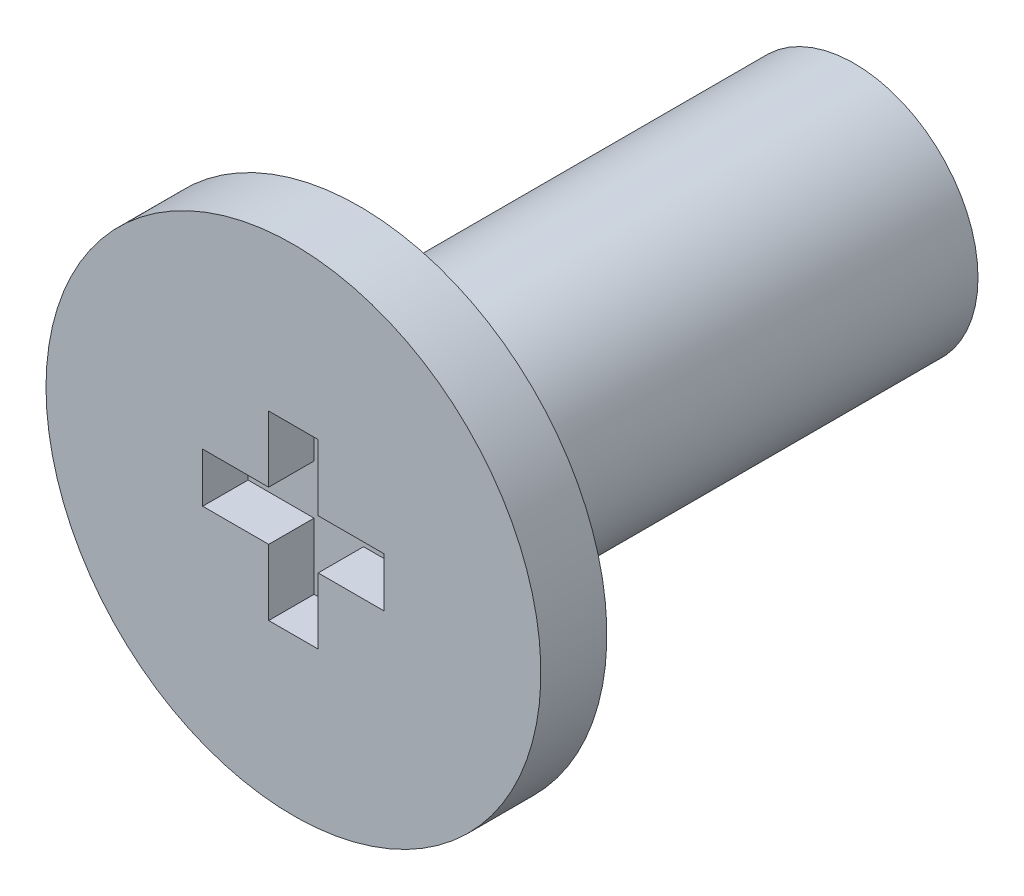
from build123d import *

# Parameters (mm, degrees)
SKETCH_1_R        = 1.5
EXTRUDE_198_DEPTH = 6
SKETCH_6_W        = 3
SKETCH_6_H        = 0.8
PH1_START         = 0.81
PH1_DEPTH         = 0.56


with BuildPart() as part:
    # 草图1 → Extrude 198 (new body)
    with BuildSketch(Plane.XY):
        Circle(SKETCH_1_R)
    extrude(amount=-EXTRUDE_198_DEPTH)

    # 草图6 → Revolve 324 (revolve)
    with BuildSketch(Plane(origin=(0, 0, 0), x_dir=(1, 0, 0), z_dir=(0, 1, 0)), mode=Mode.PRIVATE) as revolve_324_sk:
        with Locations((1.5, -0.4)):
            Rectangle(SKETCH_6_W, SKETCH_6_H)
    revolve(revolve_324_sk.sketch.rotate(Axis((0, 0, -2), (0, 0, 1)), 180), axis=Axis((0, 0, -2), (0, 0, 1)))

    # 草图7 → 十字槽_PH1_简化 (cut)
    with BuildSketch(Plane.XY.offset(PH1_START)):
        Polygon((-0.3, -1.1), (0.3, -1.1), (0.3, -0.3), (1.1, -0.3), (1.1, 0.3), (0.3, 0.3), (0.3, 1.1), (-0.3, 1.1), (-0.3, 0.3), (-1.1, 0.3), (-1.1, -0.3), (-0.3, -0.3), align=None)
    extrude(amount=-PH1_DEPTH, mode=Mode.SUBTRACT)


solid = part.part
